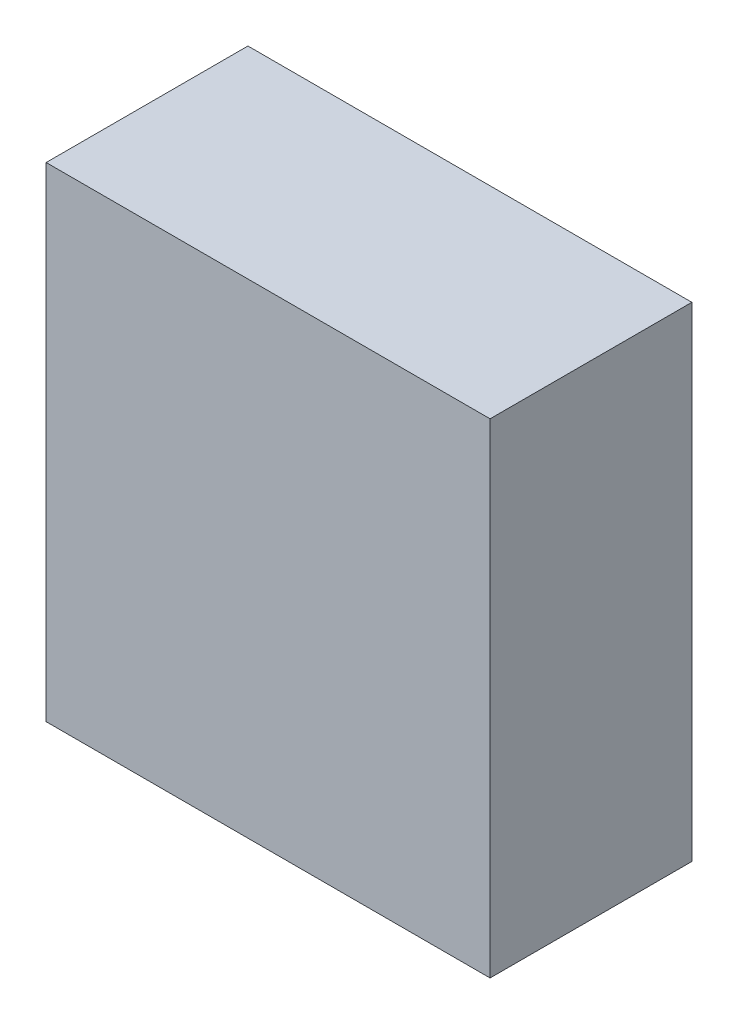
from build123d import *

# Parameters (mm, degrees)
SKETCH1_W           = 7.2
SKETCH1_H           = 6.6
BOSS_EXTRUDE1_DEPTH = 3


with BuildPart() as part:
    # Sketch1 → Boss-Extrude1 (new body)
    with BuildSketch(Plane(origin=(0, 0, 0), x_dir=(0, 1, 0), z_dir=(0, 0, 1))):
        Rectangle(SKETCH1_W, SKETCH1_H)
    extrude(amount=BOSS_EXTRUDE1_DEPTH)


solid = part.part
